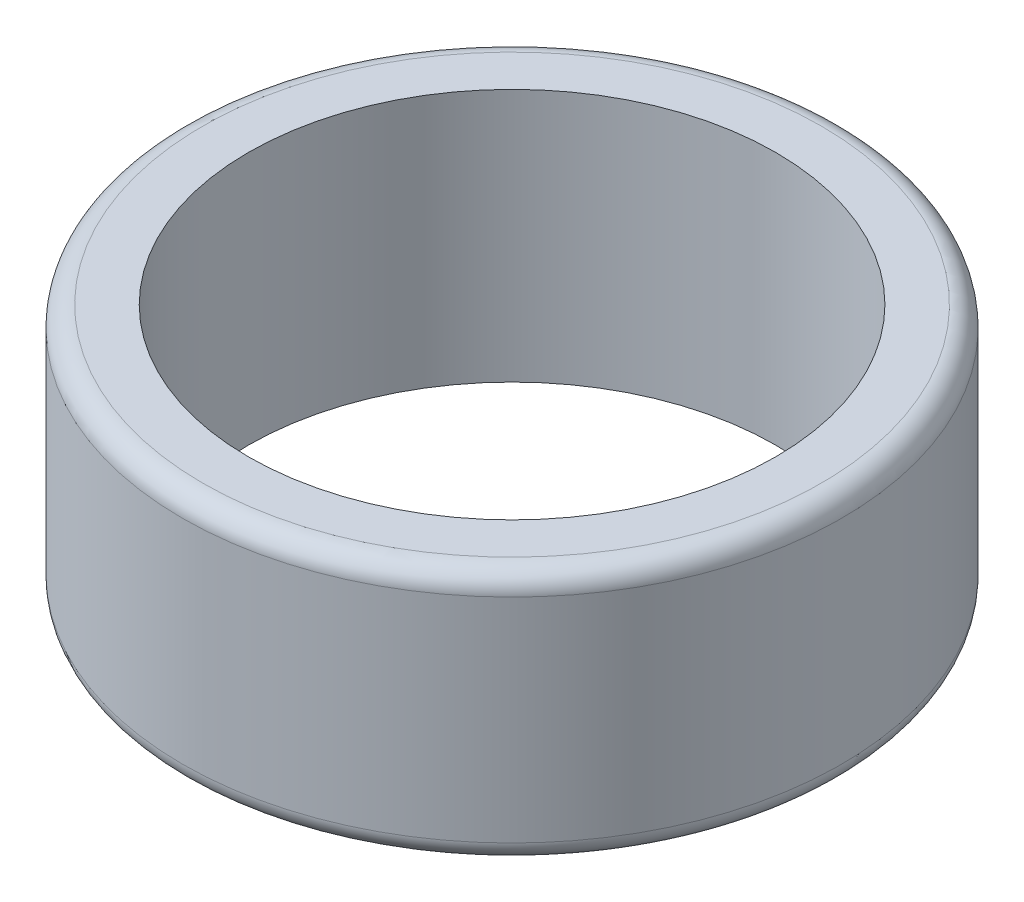
from build123d import *

# Parameters (mm, degrees)
SKETCH2_R           = 32.5
SKETCH2_R_2         = 26
BOSS_EXTRUDE1_DEPTH = 25
FILLET2_R           = 2


with BuildPart() as part:
    # Sketch2 → Boss-Extrude1 (new body)
    with BuildSketch(Plane(origin=(0, 0, 0), x_dir=(1, 0, 0), z_dir=(0, 1, 0))):
        with Locations(Location((0, 0, 0), (0, 0, 270))):
            Circle(SKETCH2_R)
        with Locations(Location((0, 0, 0), (0, 0, 270))):
            Circle(SKETCH2_R_2, mode=Mode.SUBTRACT)
    extrude(amount=BOSS_EXTRUDE1_DEPTH)

    # Fillet2
    fillet2_edges = [part.edges().sort_by_distance(p)[0] for p in [
        (0, 0, -32.5),
        (0, 25, -32.5),
    ]]
    fillet(fillet2_edges, radius=FILLET2_R)


solid = part.part
